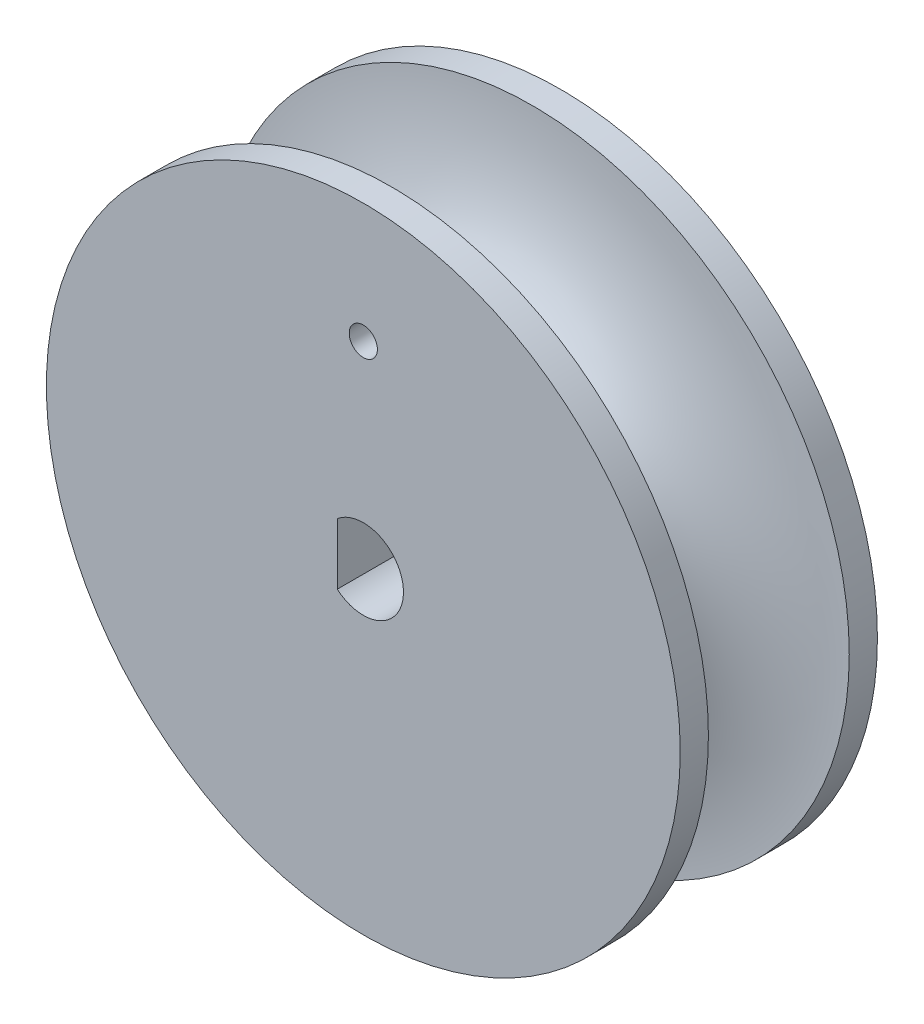
from build123d import *

# Parameters (mm, degrees)
BOSS_EXTRUDE1_START = -7
BOSS_EXTRUDE1_DEPTH = 7
SKETCH8_R           = 0.5
CUT_EXTRUDE1_DEPTH  = 3


with BuildPart() as part:
    # Sketch4 → Revolve1 (revolve)
    with BuildSketch(Plane(origin=(0, 0, 0), x_dir=(0, 0, -1), z_dir=(1, 0, 0)), mode=Mode.PRIVATE) as revolve1_sk:
        with BuildLine():
            Line((-2.5, 11.25), (-3.5, 11.25))
            Line((-3.5, 11.25), (-3.5, 1.425))
            Line((-3.5, 1.425), (3.5, 1.425))
            Line((3.5, 1.425), (3.5, 11.25))
            Line((3.5, 11.25), (2.5, 11.25))
            add(Edge.make_bspline(
                [(0, 5.689829973), (2.5, 5.689829973), (2.5, 11.25)],
                knots=[0, 0, 0, 1.570796327, 1.570796327, 1.570796327], degree=2, weights=[1, 0.707106781, 1]))
            add(Edge.make_bspline(
                [(-2.5, 11.25), (-2.5, 5.689829973), (0, 5.689829973)],
                knots=[4.71238898, 4.71238898, 4.71238898, 6.283185307, 6.283185307, 6.283185307], degree=2, weights=[1, 0.707106781, 1]))
        make_face()
    revolve(revolve1_sk.sketch.rotate(Axis((0, 0, 0), (0, 0, -1)), 90), axis=Axis((0, 0, 0), (0, 0, -1)))

    # Sketch7 → Boss-Extrude1 (add)
    with BuildSketch(Plane.XY.offset(3.5).offset(BOSS_EXTRUDE1_START)):
        with BuildLine():
            Line((-0.925, 1.083974169), (-0.925, -1.083974169))
            ThreePointArc((-0.925, -1.083974169), (-1.425, 0), (-0.925, 1.083974169))
        make_face()
    extrude(amount=BOSS_EXTRUDE1_DEPTH)

    # Sketch8 → Cut-Extrude1 (cut)
    with BuildSketch(Plane.XY.offset(3.5)):
        with Locations((0, 7)):
            Circle(SKETCH8_R)
    extrude(amount=-CUT_EXTRUDE1_DEPTH, mode=Mode.SUBTRACT)


solid = part.part
